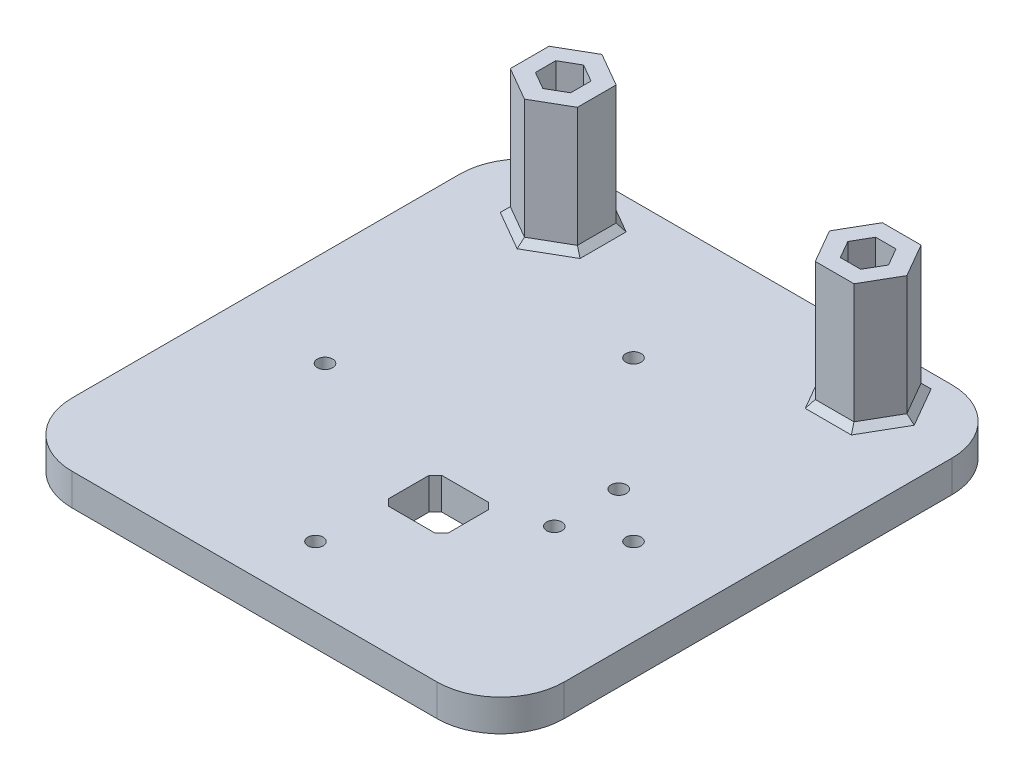
from build123d import *

# Parameters (mm, degrees)
SKETCH1_W                                       = 38.677516632
SKETCH1_H                                       = 80.9364214
BOSS_EXTRUDE1_DEPTH                             = 5
FILLET1_R                                       = 10
BOSS_EXTRUDE2_DEPTH                             = 19.8
CHAMFER1_SIZE                                   = 1
CSK_FOR_M2_FLAT_HEAD_MACHINE_SCREW1_D           = 2.4
CSK_FOR_M2_FLAT_HEAD_MACHINE_SCREW1_CSINK_D     = 4.4
CSK_FOR_M2_FLAT_HEAD_MACHINE_SCREW1_CSINK_ANGLE = 90
CUT_EXTRUDE3_REACH                              = 63.226
SKETCH12_W                                      = 9.354156198
SKETCH12_H                                      = 8.387423898
CHAMFER3_SIZE                                   = 1
SKETCH15_R                                      = 1.2
CUT_EXTRUDE4_DEPTH                              = 10


with BuildPart() as part:
    # Sketch1 → Boss-Extrude1 (new body)
    # profile 1 of 2: a face of its own
    with BuildSketch(Plane(origin=(0, 0, 0), x_dir=(1, 0, 0), z_dir=(0, 1, 0))):
        with Locations((19.338758316, 0)):
            Rectangle(SKETCH1_W, SKETCH1_H)
        Polygon((25.6, 34.765367903), (27.2, 31.994086611), (25.6, 29.222805318), (22.4, 29.222805318), (20.8, 31.994086611), (22.4, 34.765367903), align=None, mode=Mode.SUBTRACT)
    # profile 2 of 2: a face of its own
    with BuildSketch(Plane(origin=(0, 0, 0), x_dir=(1, 0, 0), z_dir=(0, 1, 0))):
        with Locations((-19.338758316, 0)):
            Rectangle(SKETCH1_W, SKETCH1_H)
        Polygon((-24, 35.251299163), (-21.228718708, 33.651299163), (-21.228718708, 30.451299163), (-24, 28.851299163), (-26.771281292, 30.451299163), (-26.771281292, 33.651299163), align=None, mode=Mode.SUBTRACT)
    extrude(amount=BOSS_EXTRUDE1_DEPTH)

    # Fillet1
    fillet1_edges = [part.edges().sort_by_distance(p)[0] for p in [
        (-38.677516632, 2.5, 40.4682107),
        (-38.677516632, 2.5, -40.4682107),
        (38.677516632, 2.5, -40.4682107),
        (38.677516632, 2.5, 40.4682107),
    ]]
    fillet(fillet1_edges, radius=FILLET1_R)

    # Sketch7 → Boss-Extrude2 (add)
    # profile 1 of 2: a face of its own
    with BuildSketch(Plane(origin=(0, 5, 0), x_dir=(1, 0, 0), z_dir=(0, 1, 0))):
        Polygon((-18.728718708, 35.094674836), (-24, 38.138050509), (-29.271281292, 35.094674836), (-29.271281292, 29.00792349), (-24, 25.964547817), (-18.728718708, 29.00792349), align=None)
        Polygon((-21.228718708, 30.451299163), (-21.228718708, 33.651299163), (-24, 35.251299163), (-26.771281292, 33.651299163), (-26.771281292, 30.451299163), (-24, 28.851299163), align=None, mode=Mode.SUBTRACT)
    # profile 2 of 2: a face of its own
    with BuildSketch(Plane(origin=(0, 5, 0), x_dir=(1, 0, 0), z_dir=(0, 1, 0))):
        Polygon((27.043375673, 37.265367903), (20.956624327, 37.265367903), (17.913248654, 31.994086611), (20.956624327, 26.722805318), (27.043375673, 26.722805318), (30.086751346, 31.994086611), align=None)
        Polygon((25.6, 34.765367903), (22.4, 34.765367903), (20.8, 31.994086611), (22.4, 29.222805318), (25.6, 29.222805318), (27.2, 31.994086611), align=None, mode=Mode.SUBTRACT)
    extrude(amount=BOSS_EXTRUDE2_DEPTH)

    # Chamfer1
    chamfer1_edges = [part.edges().sort_by_distance(p)[0] for p in [
        (-18.728718708, 5, -32.051299163),
        (-21.364359354, 5, -36.616362672),
        (-26.635640646, 5, -36.616362672),
        (-29.271281292, 5, -32.051299163),
        (-26.635640646, 5, -27.486235653),
        (-21.364359354, 5, -27.486235653),
        (28.565063509, 5, -34.629727257),
        (24, 5, -37.265367903),
        (19.434936491, 5, -34.629727257),
        (19.434936491, 5, -29.358445964),
        (24, 5, -26.722805318),
        (28.565063509, 5, -29.358445964),
    ]]
    chamfer(chamfer1_edges, length=CHAMFER1_SIZE)

    # CSK for M2 Flat Head Machine Screw1 (through all)
    with Locations(Plane(origin=(0, 0, 0), x_dir=(-1, 0, 0), z_dir=(0, -1, 0))):
        with Locations((-25, -5.898372583), (0, -30.898372583), (23.5, -5.898372583), (0, 19.101627417)):
            CounterSinkHole(CSK_FOR_M2_FLAT_HEAD_MACHINE_SCREW1_D / 2, CSK_FOR_M2_FLAT_HEAD_MACHINE_SCREW1_CSINK_D / 2, counter_sink_angle=CSK_FOR_M2_FLAT_HEAD_MACHINE_SCREW1_CSINK_ANGLE)

    # Sketch12 → Cut-Extrude3 (cut, up to next)
    with BuildSketch(Plane.XZ, mode=Mode.PRIVATE) as cut_extrude3_sk1:
        with Locations((4.598685832, 16.15981243)):
            Rectangle(SKETCH12_W, SKETCH12_H)
    cut_extrude3_tool1 = extrude(cut_extrude3_sk1.sketch, amount=-CUT_EXTRUDE3_REACH, mode=Mode.PRIVATE) & part.part
    add(cut_extrude3_tool1.solids().sort_by_distance((4.598686, 0, 16.159812))[0], mode=Mode.SUBTRACT)

    # Chamfer3
    chamfer3_edges = [part.edges().sort_by_distance(p)[0] for p in [
        (9.275763931, 2.5, 20.353524379),
        (9.275763931, 2.5, 11.966100481),
        (-0.078392267, 2.5, 11.966100481),
        (-0.078392267, 2.5, 20.353524379),
    ]]
    chamfer(chamfer3_edges, length=CHAMFER3_SIZE)

    # Sketch15 → Cut-Extrude4 (cut)
    with BuildSketch(Plane(origin=(0, 5, 0), x_dir=(1, 0, 0), z_dir=(0, 1, 0))):
        with Locations(Location((16.71400844, -10.060201476, 0), (0, 0, 270))):
            Circle(SKETCH15_R)
        with Locations(Location((16.71400844, 0.06847889, 0), (0, 0, 270))):
            Circle(SKETCH15_R)
    extrude(amount=-CUT_EXTRUDE4_DEPTH, mode=Mode.SUBTRACT)


solid = part.part
